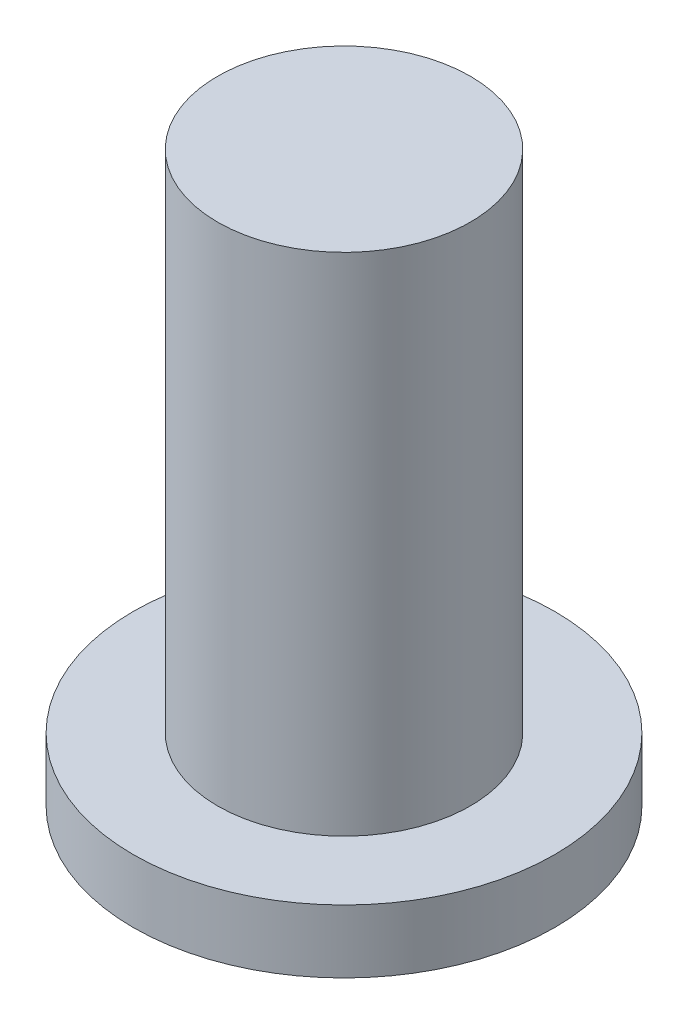
from build123d import *

# Parameters (mm, degrees)
SKETCH2_R           = 5
BOSS_EXTRUDE1_DEPTH = 1.5
SKETCH3_R           = 3
BOSS_EXTRUDE2_DEPTH = 12


with BuildPart() as part:
    # Sketch2 → Boss-Extrude1 (new body)
    with BuildSketch(Plane(origin=(0, 0, 0), x_dir=(1, 0, 0), z_dir=(0, 1, 0))):
        with Locations(Location((0, 0, 0), (0, 0, 270))):
            Circle(SKETCH2_R)
    extrude(amount=BOSS_EXTRUDE1_DEPTH)

    # Sketch3 → Boss-Extrude2 (add)
    with BuildSketch(Plane(origin=(0, 1.5, 0), x_dir=(1, 0, 0), z_dir=(0, 1, 0))):
        with Locations(Location((0, 0, 0), (0, 0, 270))):
            Circle(SKETCH3_R)
    extrude(amount=BOSS_EXTRUDE2_DEPTH)


solid = part.part
